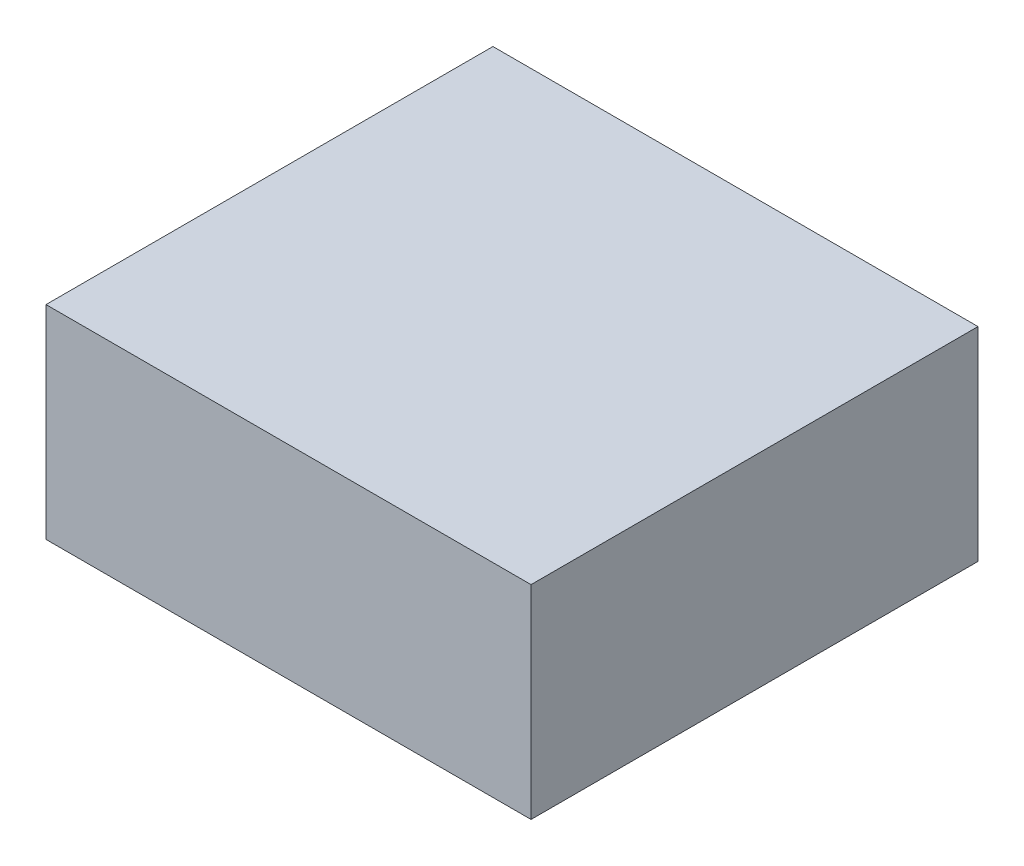
from build123d import *

# Parameters (mm, degrees)
SKETCH_1_W      = 181.102
SKETCH_1_H      = 166.878
EXTRUDE_1_DEPTH = 75.946


with BuildPart() as part:
    # 草图1 → 凸台-拉伸1 (new body)
    with BuildSketch(Plane(origin=(0, 0, 0), x_dir=(1, 0, 0), z_dir=(0, 1, 0))):
        Rectangle(SKETCH_1_W, SKETCH_1_H)
    extrude(amount=EXTRUDE_1_DEPTH)


solid = part.part
